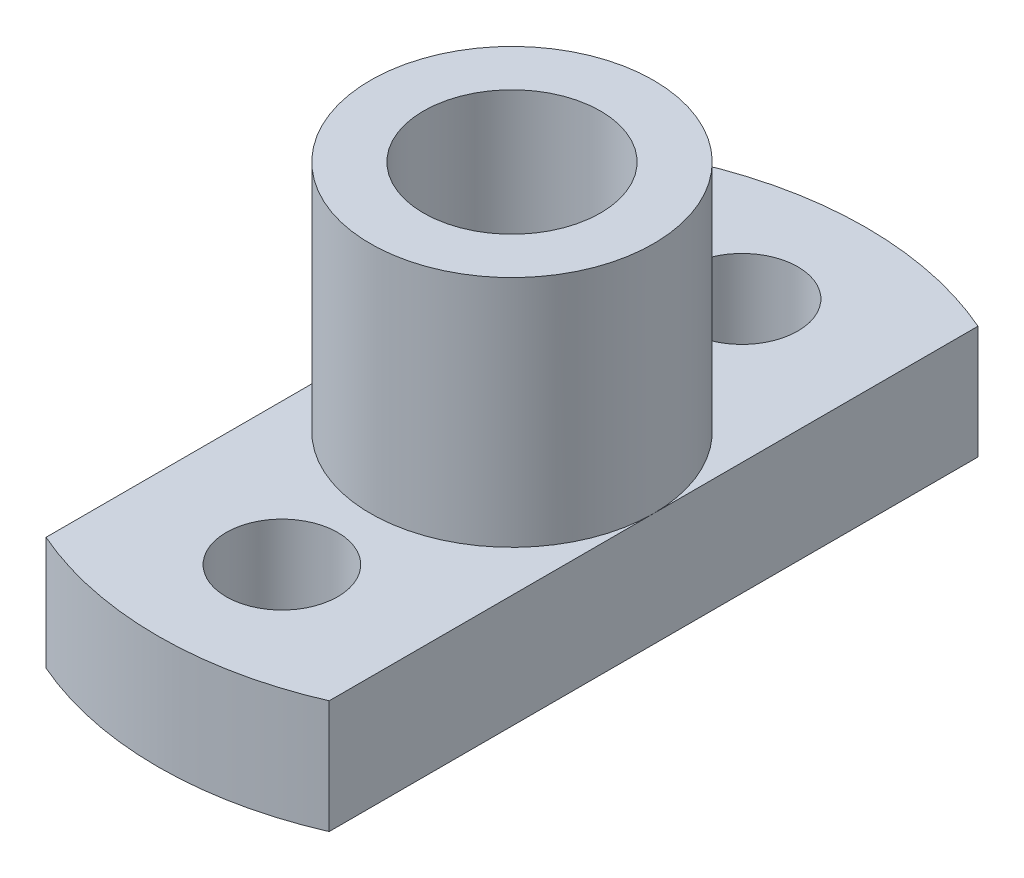
from build123d import *

# Parameters (mm, degrees)
ESQUISSE2_R             = 1.575
ENL_V_MAT_EXTRU_1_DEPTH = 18.205812971
ESQUISSE3_OUTSIDE_W     = 27.986
ESQUISSE3_OUTSIDE_H     = 27.986
ESQUISSE3_OUTSIDE_W_2   = 8
ESQUISSE3_OUTSIDE_H_2   = 20
ENL_V_MAT_EXTRU_2_DEPTH = 18.205812971


with BuildPart() as part:
    # Esquisse1 → Révolution1 (revolve)
    with BuildSketch(Plane.XY, mode=Mode.PRIVATE) as r_volution1_sk:
        Polygon((2.5, 0), (10, 0), (10, 3.2), (4, 3.2), (4, 9.8), (2.5, 9.8), align=None)
    revolve(r_volution1_sk.sketch.rotate(Axis((0, 0, 0), (0, 1, 0)), 90), axis=Axis((0, 0, 0), (0, 1, 0)))

    # Esquisse2 → Enlèv. mat.-Extru.1 (cut, through all)
    with BuildSketch(Plane.XZ):
        with Locations(Location((0, 6.5, 0), (0, 0, 270))):
            Circle(ESQUISSE2_R)
        with Locations(Location((5.629165125, -3.25, 0), (0, 0, 270))):
            Circle(ESQUISSE2_R)
        with Locations(Location((-5.629165125, -3.25, 0), (0, 0, 270))):
            Circle(ESQUISSE2_R)
        with Locations(Location((0, -6.5, 0), (0, 0, 270))):
            Circle(ESQUISSE2_R)
    extrude(amount=-ENL_V_MAT_EXTRU_1_DEPTH, mode=Mode.SUBTRACT)

    # Esquisse3 outside → Enlèv. mat.-Extru.2 (cut, through all)
    with BuildSketch(Plane.XZ):
        Rectangle(ESQUISSE3_OUTSIDE_W, ESQUISSE3_OUTSIDE_H)
        Rectangle(ESQUISSE3_OUTSIDE_W_2, ESQUISSE3_OUTSIDE_H_2, mode=Mode.SUBTRACT)
    extrude(amount=-ENL_V_MAT_EXTRU_2_DEPTH, mode=Mode.SUBTRACT)


solid = part.part
